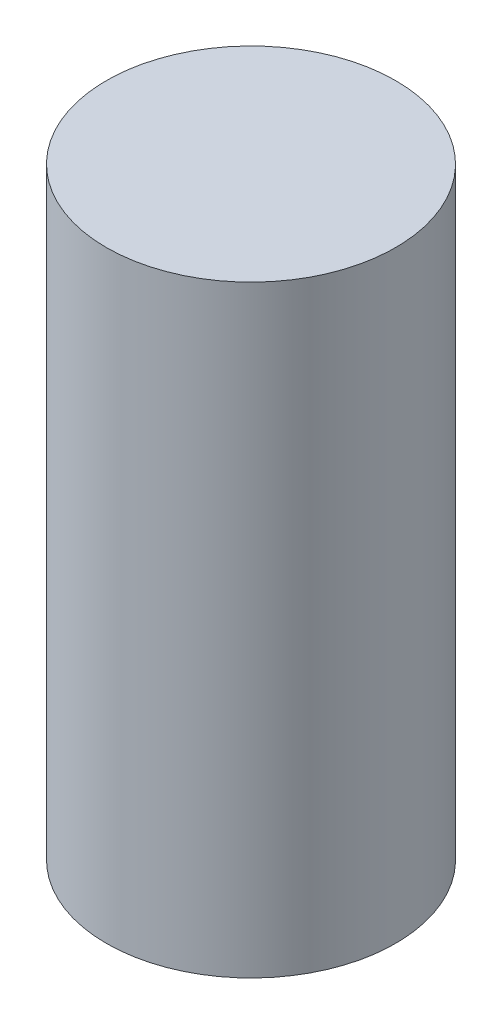
from build123d import *

# Parameters (mm, degrees)
SKETCH1_R           = 3.048
BOSS_EXTRUDE1_DEPTH = 6.35


with BuildPart() as part:
    # Sketch1 → Boss-Extrude1 (new, symmetric)
    with BuildSketch(Plane(origin=(0, 0, 0), x_dir=(1, 0, 0), z_dir=(0, 1, 0))):
        with Locations(Location((0, 0, 0), (0, 0, 270))):
            Circle(SKETCH1_R)
    extrude(amount=BOSS_EXTRUDE1_DEPTH, both=True)


solid = part.part
